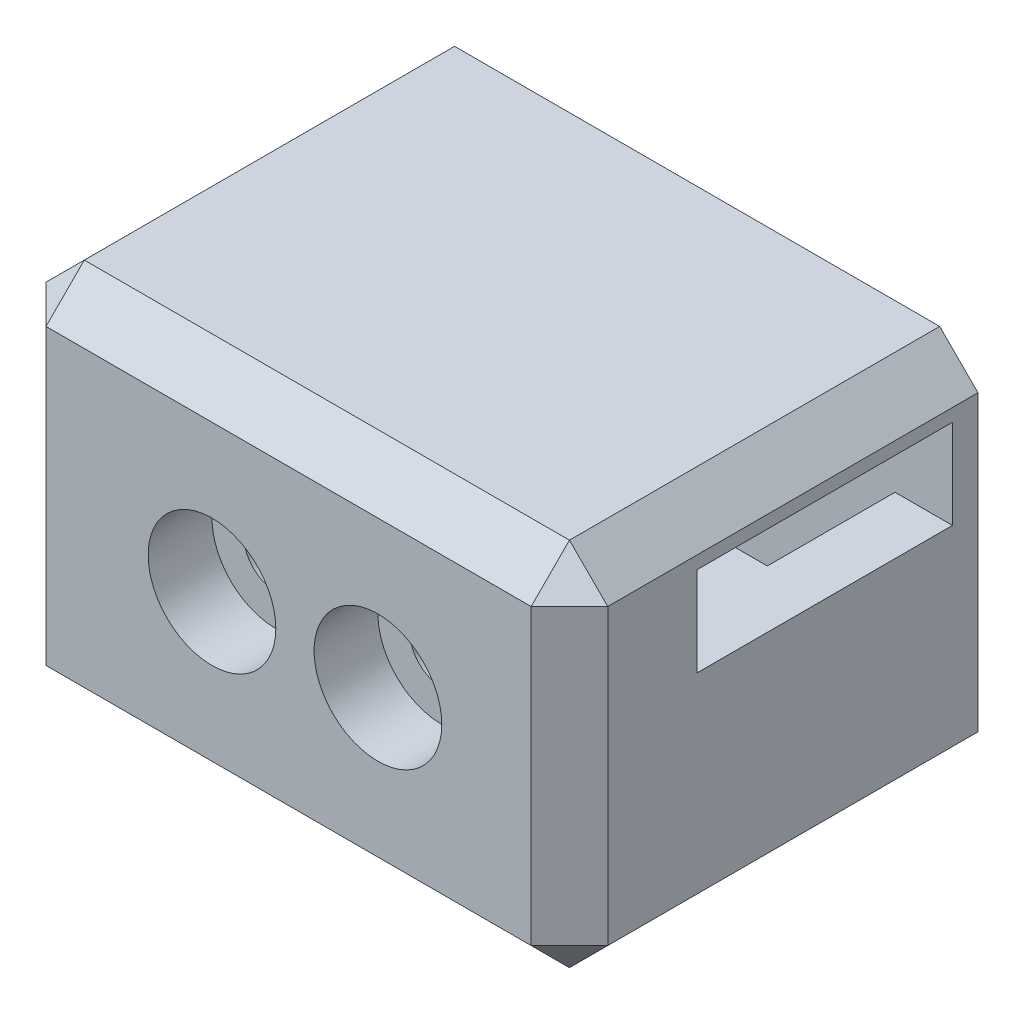
from build123d import *

# Parameters (mm, degrees)
SKETCH1_W           = 44
SKETCH1_H           = 29
SKETCH1_R           = 2.5
BOSS_EXTRUDE1_DEPTH = 30
CUT_EXTRUDE1_DEPTH  = 25
SKETCH3_W           = 20
SKETCH3_H           = 7
CUT_EXTRUDE2_DEPTH  = 29
SKETCH4_R           = 5
CUT_EXTRUDE3_DEPTH  = 3
THICKEN1_T1         = 2
CHAMFER1_SIZE       = 3
CHAMFER2_SIZE       = 4
CUT_EXTRUDE4_DEPTH  = 0.3


with BuildPart() as part:
    # Sketch1 → Boss-Extrude1 (new body)
    with BuildSketch(Plane.XY.offset(794.620141885)):
        with Locations((45.789156386, -208.298939869)):
            Rectangle(SKETCH1_W, SKETCH1_H)
        with Locations((52.789156386, -208.298939869)):
            Circle(SKETCH1_R, mode=Mode.SUBTRACT)
        with Locations((39.789156386, -208.298939869)):
            Circle(SKETCH1_R, mode=Mode.SUBTRACT)
    extrude(amount=BOSS_EXTRUDE1_DEPTH)

    # Sketch2 → Cut-Extrude1 (cut)
    with BuildSketch(Plane.XZ.offset(222.798939869)):
        Polygon((28.289156386, 816.620141885), (49.789156386, 816.620141885), (49.789156386, 806.620141885), (63.289156386, 806.620141885), (63.289156386, 796.620141885), (42.789156386, 796.620141885), (42.789156386, 806.620141885), (28.289156386, 806.620141885), align=None)
    extrude(amount=-CUT_EXTRUDE1_DEPTH, mode=Mode.SUBTRACT)

    # Sketch3 → Cut-Extrude2 (cut)
    with BuildSketch(Plane(origin=(42.789156386, 0, 0), x_dir=(0, 0, -1), z_dir=(1, 0, 0))):
        with Locations((-806.620141885, -201.298939869)):
            Rectangle(SKETCH3_W, SKETCH3_H)
    extrude(amount=CUT_EXTRUDE2_DEPTH, mode=Mode.SUBTRACT)

    # Sketch4 → Cut-Extrude3 (cut)
    with BuildSketch(Plane.XY.offset(824.620141885)):
        with Locations((39.789156386, -208.298939869)):
            Circle(SKETCH4_R)
        with Locations((52.789156386, -208.298939869)):
            Circle(SKETCH4_R)
    extrude(amount=-CUT_EXTRUDE3_DEPTH, mode=Mode.SUBTRACT)

    # Surface-Offset1: a surface, a copy of 1 face of the part
    surface_offset1_1 = part.part.faces().sort_by_distance((45.718963888, -208.298939869, 824.620141885))[0]
    add(Solid.thicken(surface_offset1_1, THICKEN1_T1))

    # Chamfer1
    chamfer1_edges = [part.edges().sort_by_distance(p)[0] for p in [
        (67.789156386, -222.798939869, 810.620141885),
        (23.789156386, -222.798939869, 810.620141885),
        (23.789156386, -193.798939869, 810.620141885),
        (67.789156386, -193.798939869, 810.620141885),
        (67.789156386, -208.298939869, 826.620141885),
        (45.789156386, -193.798939869, 826.620141885),
        (23.789156386, -208.298939869, 826.620141885),
        (45.789156386, -222.798939869, 826.620141885),
    ]]
    chamfer(chamfer1_edges, length=CHAMFER1_SIZE)

    # Chamfer2
    chamfer2_edges = [part.edges().sort_by_distance(p)[0] for p in [
        (42.789156386, -222.798939869, 801.620141885),
        (49.789156386, -222.798939869, 811.620141885),
    ]]
    chamfer(chamfer2_edges, length=CHAMFER2_SIZE)

    # Sketch5 → Cut-Extrude4 (cut)
    with BuildSketch(Plane.ZY.offset(-23.789156386)):
        with BuildLine():
            Line((818.620141885, -202.649682189), (818.620141885, -206.652086035))
            add(Edge.make_bspline(
                [(818.620141885, -206.652086035), (818.619252822, -206.919178198), (818.617545723, -207.432024737), (818.608027078, -208.166729139), (818.580745045, -208.834312551), (818.557267425, -209.434425918), (818.514456332, -209.967058232), (818.473538348, -210.433842751), (818.419974572, -210.832629594), (818.370229298, -211.074034458), (818.347705987, -211.183336035)],
                knots=[0, 0, 0, 0, 1.410062039, 2.707475311, 3.878576406, 4.937260626, 5.877586885, 6.699081471, 7.410979367, 8, 8, 8, 8], degree=3))
            add(Edge.make_bspline(
                [(818.347705987, -211.183336035), (818.311557144, -211.329662179), (818.240030609, -211.619192932), (818.088773389, -212.036013061), (817.914023625, -212.43337572), (817.707180436, -212.809789724), (817.471851613, -213.165289992), (817.206662217, -213.499344244), (816.910261737, -213.810042595), (816.590218995, -214.099775718), (816.243741522, -214.36240947), (815.875876555, -214.589684619), (815.488924875, -214.784299189), (815.081538972, -214.939665852), (814.657162625, -215.06465357), (814.212090229, -215.15281158), (813.748311447, -215.205673278), (813.431980786, -215.211055618), (813.271584192, -215.213784753)],
                knots=[0, 0, 0, 0, 1.02737288, 2.032829108, 3.019628684, 3.985738875, 4.958353778, 5.924249254, 6.890702889, 7.883913451, 8.865824512, 9.85161466, 10.829249435, 11.81541824, 12.821369441, 13.843154991, 14.906364023, 16, 16, 16, 16], degree=3))
            add(Edge.make_bspline(
                [(813.271584192, -215.213784753), (813.005097574, -215.205390696), (812.485113159, -215.189011716), (811.730483834, -215.036293795), (811.02652923, -214.786153381), (810.374229006, -214.441407876), (809.785954605, -214.002591168), (809.271001623, -213.47523327), (808.836100367, -212.862027363), (808.537719774, -212.288492765), (808.345728912, -211.781622), (808.209965299, -211.3631096), (808.106839718, -210.906236663), (808.013112973, -210.417557724), (807.941591938, -209.893298179), (807.89079841, -209.334513757), (807.858137784, -208.739806906), (807.853365927, -208.332151125), (807.850911115, -208.122438599)],
                knots=[0, 0, 0, 0, 1.260402266, 2.459371274, 3.627181936, 4.786749125, 5.93865593, 7.087644312, 8.261344208, 9.485713728, 10.136162886, 10.825977872, 11.566646758, 12.35154167, 13.181268117, 14.0701832, 15.007234106, 16, 16, 16, 16], degree=3))
            Line((807.850911115, -208.122438599), (798.620141885, -215.470195009))
            Line((798.620141885, -215.470195009), (798.620141885, -213.250643727))
            Line((798.620141885, -213.250643727), (807.850911115, -205.902887317))
            Line((807.850911115, -205.902887317), (807.850911115, -204.444553983))
            Line((807.850911115, -204.444553983), (798.620141885, -204.444553983))
            Line((798.620141885, -204.444553983), (798.620141885, -202.649682189))
            Line((798.620141885, -202.649682189), (818.620141885, -202.649682189))
        make_face()
        with BuildLine():
            Line((816.568859833, -204.444553983), (809.902193167, -204.444553983))
            Line((809.902193167, -204.444553983), (809.874148295, -208.106412958))
            add(Edge.make_bspline(
                [(809.874148295, -208.106412958), (809.874072657, -208.277384608), (809.87392605, -208.608776362), (809.896747622, -209.088208742), (809.922709465, -209.534609347), (809.962419927, -209.946270897), (810.013597756, -210.323376683), (810.077613908, -210.665740215), (810.152200057, -210.973913839), (810.26762556, -211.333350133), (810.45060064, -211.734593079), (810.716361518, -212.17119904), (811.052793662, -212.541742888), (811.431384321, -212.861223503), (811.85619796, -213.107304946), (812.308378702, -213.286409063), (812.784022722, -213.398806876), (813.110718973, -213.412169388), (813.275590603, -213.418912958)],
                knots=[0, 0, 0, 0, 1.14660753, 2.222451964, 3.218720504, 4.145691244, 4.995719623, 5.770487122, 6.480909919, 7.121111896, 8.299844659, 9.430703709, 10.534634535, 11.641396424, 12.741395289, 13.810956493, 14.895269934, 16, 16, 16, 16], degree=3))
            add(Edge.make_bspline(
                [(813.275590603, -213.418912958), (813.436472769, -213.412148659), (813.755282519, -213.398744286), (814.220730727, -213.286191288), (814.663169936, -213.104434652), (815.074166958, -212.849569783), (815.450349769, -212.541604679), (815.767772153, -212.175850326), (816.033594898, -211.77072656), (816.20222429, -211.391811004), (816.305816002, -211.053364398), (816.378622654, -210.759466647), (816.43761036, -210.426125104), (816.483472188, -210.054138637), (816.524742591, -209.644180232), (816.551501228, -209.195127342), (816.567674152, -208.707498527), (816.568455408, -208.369514628), (816.568859833, -208.194553983)],
                knots=[0, 0, 0, 0, 1.100801541, 2.181386982, 3.260112282, 4.364594493, 5.481957178, 6.577424609, 7.668452592, 8.790448866, 9.403819393, 10.091598921, 10.863153553, 11.720938239, 12.658472417, 13.685008818, 14.801622349, 16, 16, 16, 16], degree=3))
            Line((816.568859833, -208.194553983), (816.568859833, -204.444553983))
        make_face(mode=Mode.SUBTRACT)
    extrude(amount=-CUT_EXTRUDE4_DEPTH, mode=Mode.SUBTRACT)


solid = part.part
